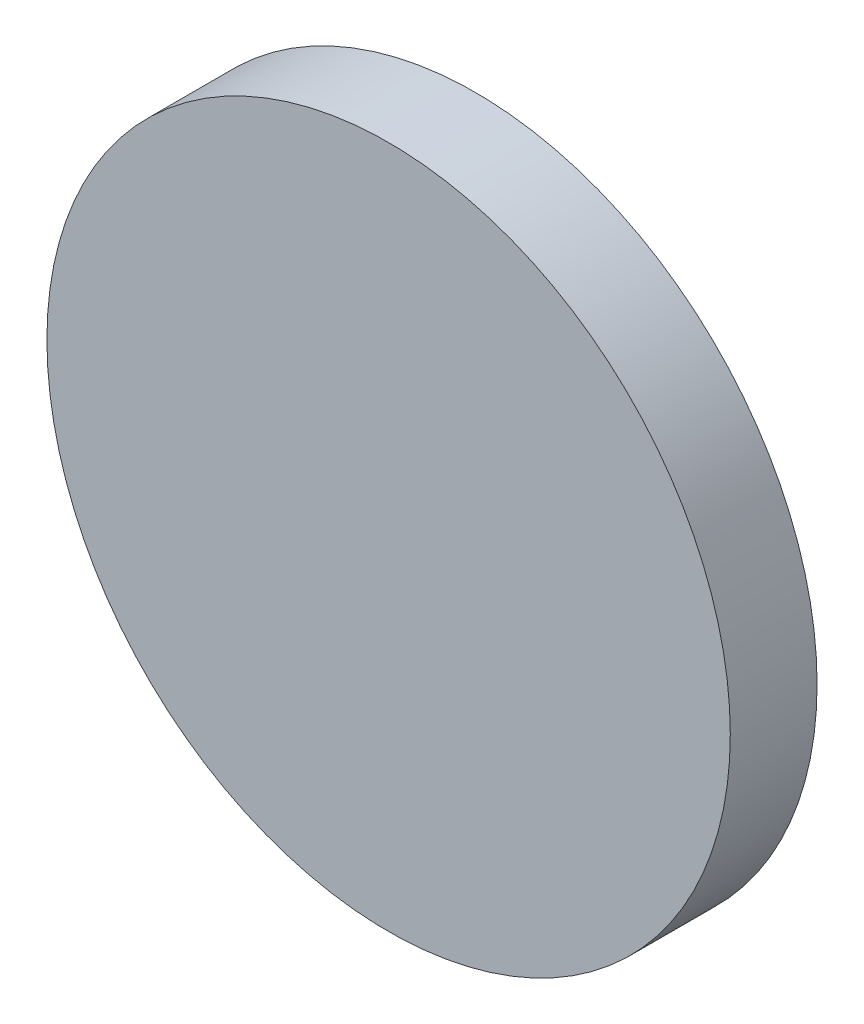
from build123d import *

# Parameters (mm, degrees)
SKETCH1_R           = 25
BOSS_EXTRUDE1_DEPTH = 6.35


with BuildPart() as part:
    # Sketch1 → Boss-Extrude1 (new body)
    with BuildSketch(Plane.XY):
        Circle(SKETCH1_R)
    extrude(amount=BOSS_EXTRUDE1_DEPTH)


solid = part.part
